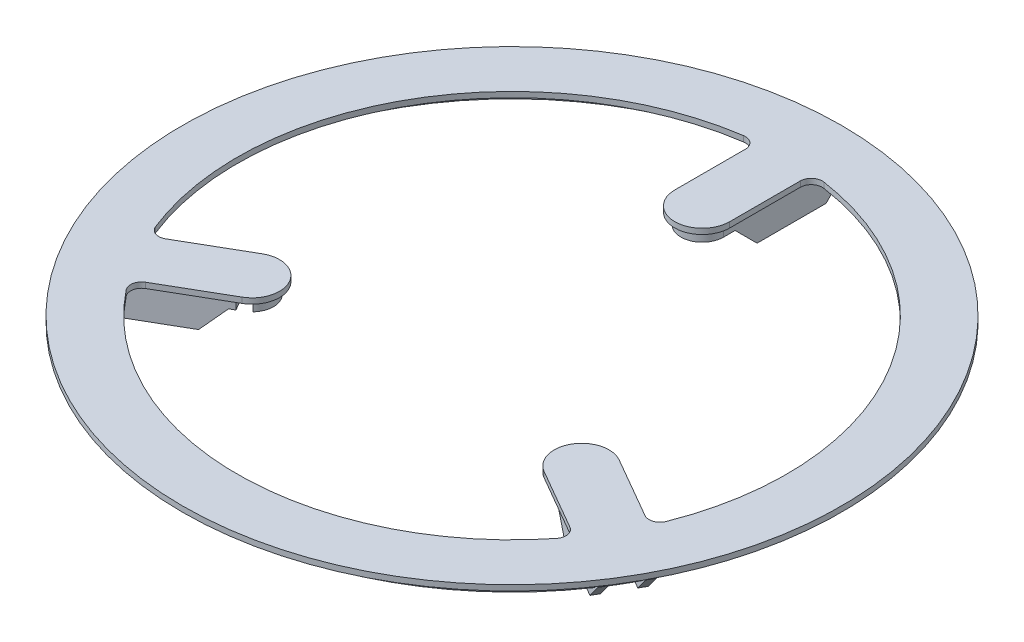
from build123d import *
from build123d.topology import SkipClean

# Parameters (mm, degrees)
SKETCH1_R                    = 150
BOSS_EXTRUDE1_DEPTH          = 2.5
BOSS_EXTRUDE2_DEPTH          = 6
SKETCH3_R                    = 2.9375
BOSS_EXTRUDE3_DEPTH          = 1
BOSS_EXTRUDE4_DEPTH          = 15
CHAMFER1_SIZE                = 10
SKETCH5_R                    = 140
SKETCH5_R_2                  = 135
BOSS_EXTRUDE5_DEPTH          = 7.5
CIRPATTERN1_COUNT            = 3
CHAMFER1_OF_CIRPATTERN1_SIZE = 10
SKETCH6_R                    = 6.263847164
BOSS_EXTRUDE6_DEPTH          = 5
CUT_EXTRUDE2_REACH           = 216.467
SKETCH7_W                    = 5.549678092
SKETCH7_H                    = 5.5
CIRPATTERN2_COUNT            = 3
FILLET1_R                    = 5


with BuildPart() as part:
    # Sketch1 → Boss-Extrude1 (new body)
    with BuildSketch(Plane(origin=(0, 0, 0), x_dir=(1, 0, 0), z_dir=(0, 1, 0))):
        with Locations(Location((0, 0, 0), (0, 0, 270))):
            Circle(SKETCH1_R)
        with BuildLine():
            Line((-12.499999821, 86.600423276), (-12.506397258, 124.372786524))
            ThreePointArc((-12.506397258, 124.372786524), (-108.253175473, 62.5), (-113.963191298, -51.355535527))
            Line((-113.963191298, -51.355535527), (-81.248166446, -32.474894246))
            ThreePointArc((-81.248166446, -32.474894246), (-64.174682453, -37.051270189), (-68.748166625, -54.12552903))
            Line((-68.748166625, -54.12552903), (-101.45679404, -73.017250997))
            ThreePointArc((-101.45679404, -73.017250997), (0, -125), (101.45679404, -73.017250997))
            Line((101.45679404, -73.017250997), (68.748166625, -54.12552903))
            ThreePointArc((68.748166625, -54.12552903), (64.174682453, -37.051270189), (81.248166446, -32.474894246))
            Line((81.248166446, -32.474894246), (113.963191298, -51.355535527))
            ThreePointArc((113.963191298, -51.355535527), (108.253175473, 62.5), (12.506397258, 124.372786524))
            Line((12.506397258, 124.372786524), (12.499999821, 86.600423276))
            ThreePointArc((12.499999821, 86.600423276), (0, 74.102540378), (-12.499999821, 86.600423276))
        make_face(mode=Mode.SUBTRACT)
    extrude(amount=BOSS_EXTRUDE1_DEPTH)

    # Sketch2 → Boss-Extrude2 (add)
    with BuildSketch(Plane.XZ):
        with BuildLine():
            Line((-76.041284798, 46.048019581), (-72.100762763, 43.773847901))
            ThreePointArc((-72.100762763, 43.773847901), (-76.468319115, 40.757071843), (-76.041284798, 46.048019581))
        make_face()
        with BuildLine():
            Line((77.89939715, 42.829674582), (73.959645685, 40.554168234))
            ThreePointArc((73.959645685, 40.554168234), (73.530819157, 45.844971017), (77.89939715, 42.829674582))
        make_face()
        with BuildLine():
            Line((-1.858112352, -88.877694162), (-1.858882922, -84.328016136))
            ThreePointArc((-1.858882922, -84.328016136), (2.937499958, -86.602042859), (-1.858112352, -88.877694162))
        make_face()
    extrude(amount=BOSS_EXTRUDE2_DEPTH)

    # Sketch3 → Boss-Extrude3 (add)
    with SkipClean():  # the faces are left unmerged after this step: merging them gives an invalid solid
        with BuildSketch(Plane.XZ):
            with Locations(Location((-75, 43.301270189, 0), (0, 0, 110.761573949))):
                Circle(SKETCH3_R)
            with Locations(Location((75, 43.301270189, 0), (0, 0, 350.761573949))):
                Circle(SKETCH3_R)
            with Locations(Location((0, -86.602540378, 0), (0, 0, 129.257834216))):
                Circle(SKETCH3_R)
        extrude(amount=BOSS_EXTRUDE3_DEPTH)

    # Sketch4 → Boss-Extrude4 (add)
    with SkipClean():  # the faces are left unmerged after this step: merging them gives an invalid solid
        with BuildSketch(Plane.XZ):
            Polygon((-128.89230729, 63.194244449), (-84.389895617, 37.50076509), (-82.639895617, 40.531854003), (-127.14230729, 66.225333363), align=None)
            Polygon((-120.923974711, 76.995801328), (-76.421563038, 51.302321968), (-74.671563038, 54.333410882), (-119.173974711, 80.026890241), align=None)
        boss_extrude4 = extrude(amount=BOSS_EXTRUDE4_DEPTH)

    # Chamfer1
    chamfer1_edges = [part.edges().sort_by_distance(p)[0] for p in [
        (-128.01730729, -15, 64.709788906),
        (-83.514895617, -15, 39.016309547),
        (-120.048974711, -15, 78.511345784),
        (-75.546563038, -15, 52.817866425),
    ]]
    chamfer(chamfer1_edges, length=CHAMFER1_SIZE)

    # Sketch5 → Boss-Extrude5 (add)
    with SkipClean():  # the faces are left unmerged after this step: merging them gives an invalid solid
        with BuildSketch(Plane.XZ):
            Circle(SKETCH5_R)
            Circle(SKETCH5_R_2, mode=Mode.SUBTRACT)
        extrude(amount=BOSS_EXTRUDE5_DEPTH)

    # CirPattern1: Boss-Extrude4 ×3 about axis
    with SkipClean():  # the faces are left unmerged after this step: merging them gives an invalid solid
        cirpattern1_axis = Axis((0, 0, 0), (0, 1, 0))
        for i in range(1, CIRPATTERN1_COUNT):
            add(boss_extrude4.rotate(cirpattern1_axis, i * 360 / CIRPATTERN1_COUNT))

    # Chamfer1 of CirPattern1
    chamfer1_of_cirpattern1_edges = [part.edges().sort_by_distance(p)[0] for p in [
        (120.048974711, -15, 78.511345784),
        (75.546563038, -15, 52.817866425),
        (128.01730729, -15, 64.709788906),
        (83.514895617, -15, 39.016309547),
        (7.968332579, -15, -143.22113469),
        (7.968332579, -15, -91.834175972),
        (-7.968332579, -15, -143.22113469),
        (-7.968332579, -15, -91.834175972),
    ]]
    chamfer(chamfer1_of_cirpattern1_edges, length=CHAMFER1_OF_CIRPATTERN1_SIZE)

    # Sketch6 → Boss-Extrude6 (add)
    with SkipClean():  # the faces are left unmerged after this step: merging them gives an invalid solid
        with BuildSketch(Plane.XZ):
            with BuildLine():
                Line((-74.671563038, 54.333410882), (-70.140833711, 51.717593085))
                ThreePointArc((-70.140833711, 51.717593085), (-66.583677104, 38.4421039), (-79.859166289, 34.884947293))
                Line((-79.859166289, 34.884947293), (-84.389895617, 37.50076509))
                Line((-84.389895617, 37.50076509), (-83.625725577, 38.824346425))
                ThreePointArc((-83.625725577, 38.824346425), (-83.416322896, 48.160436479), (-75.435733078, 53.009829547))
                Line((-75.435733078, 53.009829547), (-74.671563038, 54.333410882))
            make_face()
            with Locations(Location((-75, 43.301270189, 0), (0, 0, 270))):
                Circle(SKETCH6_R, mode=Mode.SUBTRACT)
        boss_extrude6 = extrude(amount=BOSS_EXTRUDE6_DEPTH)

    # Sketch7 → Cut-Extrude2 (cut, up to next)
    with BuildSketch(Plane(origin=(0.936307925, 0, 1.622367408), x_dir=(0.8661100754576421, 0, -0.4998533156744661), z_dir=(0.4998533156744661, 0, 0.8661100754576421)), mode=Mode.PRIVATE) as cut_extrude2_sk1:
        with Locations((-86.602539136, -3.75)):
            Rectangle(SKETCH7_W, SKETCH7_H)
    cut_extrude2_tool1 = extrude(cut_extrude2_sk1.sketch, amount=CUT_EXTRUDE2_REACH, mode=Mode.PRIVATE) & part.part
    cut_extrude2 = cut_extrude2_tool1.solids().sort_by_distance((-74.071024, -3.75, 44.910934))[0]
    add(cut_extrude2, mode=Mode.SUBTRACT)

    # CirPattern2: Boss-Extrude6, Cut-Extrude2 ×3 about axis
    with SkipClean():  # the faces are left unmerged after this step: merging them gives an invalid solid
        cirpattern2_axis = Axis((0, 0, 0), (0, 1, 0))
        add([boss_extrude6.rotate(cirpattern2_axis, i * 360 / CIRPATTERN2_COUNT) for i in range(1, CIRPATTERN2_COUNT)])
        add([cut_extrude2.rotate(cirpattern2_axis, i * 360 / CIRPATTERN2_COUNT) for i in range(1, CIRPATTERN2_COUNT)], mode=Mode.SUBTRACT)

    # Fillet1
    fillet1_edges = [part.edges().sort_by_distance(p)[0] for p in [
        (-12.506397258, 1.25, -124.372786524),
        (-113.963191298, 1.25, 51.355535527),
        (-101.45679404, 1.25, 73.017250997),
        (101.45679404, 1.25, 73.017250997),
        (113.963191298, 1.25, 51.355535527),
        (12.506397258, 1.25, -124.372786524),
    ]]
    fillet(fillet1_edges, radius=FILLET1_R)


solid = part.part
